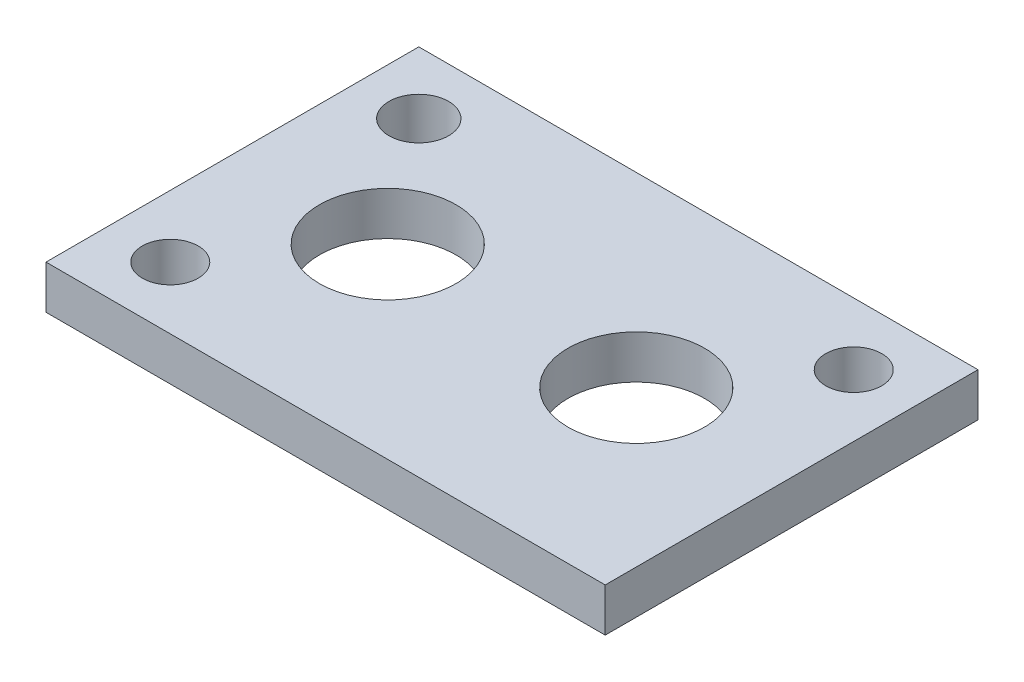
from build123d import *

# Parameters (mm, degrees)
SKETCH1_W             = 90
SKETCH1_H             = 60
BOSS_EXTRUDE1_DEPTH   = 7
M20_CLEARANCE_SLOT1_D = 22
M8_CLEARANCE_SLOT1_D  = 9
SKETCH8_R             = 4.8
CUT_EXTRUDE1_DEPTH    = 7


with BuildPart() as part:
    # Sketch1 → Boss-Extrude1 (new body)
    with BuildSketch(Plane(origin=(0, 0, 0), x_dir=(1, 0, 0), z_dir=(0, 1, 0))):
        with Locations((45, 30)):
            Rectangle(SKETCH1_W, SKETCH1_H)
    extrude(amount=BOSS_EXTRUDE1_DEPTH)

    # M20 Clearance Slot1 (through all)
    with Locations(Plane(origin=(0, 7, 0), x_dir=(1, 0, 0), z_dir=(0, 1, 0))):
        with Locations((25, 30), (65, 30)):
            Hole(M20_CLEARANCE_SLOT1_D / 2)

    # M8 Clearance Slot1 (through all)
    with Locations(Plane(origin=(0, 7, 0), x_dir=(1, 0, 0), z_dir=(0, 1, 0))):
        with Locations((80, 50), (10, 10)):
            Hole(M8_CLEARANCE_SLOT1_D / 2)

    # Sketch8 → Cut-Extrude1 (cut)
    with BuildSketch(Plane(origin=(0, 7, 0), x_dir=(1, 0, 0), z_dir=(0, 1, 0))):
        with Locations(Location((10, 50, 0), (0, 0, 270))):
            Circle(SKETCH8_R)
    extrude(amount=-CUT_EXTRUDE1_DEPTH, mode=Mode.SUBTRACT)


solid = part.part
